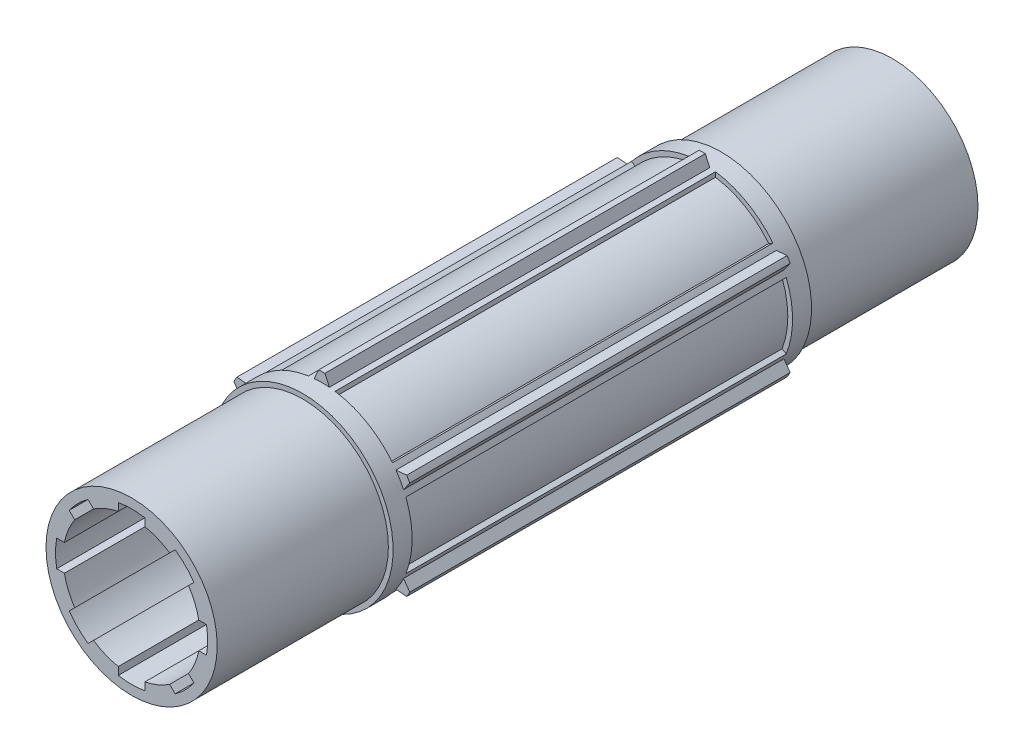
from build123d import *
from build123d.topology import SkipClean

# Parameters (mm, degrees)
SKETCH1_R           = 22.5
BOSS_EXTRUDE1_DEPTH = 200
BOSS_EXTRUDE2_START = 50
BOSS_EXTRUDE2_DEPTH = 100
BOSS_EXTRUDE3_START = -50
SKETCH4_R           = 23.75
SKETCH4_R_2         = 22.5
BOSS_EXTRUDE3_DEPTH = 5
BOSS_EXTRUDE4_START = -155
SKETCH4_2_R         = 23.75
SKETCH4_2_R_2       = 22.5
BOSS_EXTRUDE4_DEPTH = 5


with BuildPart() as part:
    # Sketch1 → Boss-Extrude1 (new body)
    with BuildSketch(Plane.XY):
        Circle(SKETCH1_R)
        with BuildLine():
            Line((-3.5, 19.691368668), (-3.5, 17.656443583))
            ThreePointArc((-3.5, 17.656443583), (-6.888301783, 16.629831585), (-10.010117255, 14.959864723))
            Line((-10.010117255, 14.959864723), (-11.449026581, 16.39877405))
            ThreePointArc((-11.449026581, 16.39877405), (-14.142135624, 14.142135624), (-16.39877405, 11.449026581))
            Line((-16.39877405, 11.449026581), (-14.959864723, 10.010117255))
            ThreePointArc((-14.959864723, 10.010117255), (-16.629831585, 6.888301783), (-17.656443583, 3.5))
            Line((-17.656443583, 3.5), (-19.691368668, 3.5))
            ThreePointArc((-19.691368668, 3.5), (-20, 0), (-19.691368668, -3.5))
            Line((-19.691368668, -3.5), (-17.656443583, -3.5))
            ThreePointArc((-17.656443583, -3.5), (-16.629831585, -6.888301783), (-14.959864723, -10.010117255))
            Line((-14.959864723, -10.010117255), (-16.39877405, -11.449026581))
            ThreePointArc((-16.39877405, -11.449026581), (-14.142135624, -14.142135624), (-11.449026581, -16.39877405))
            Line((-11.449026581, -16.39877405), (-10.010117255, -14.959864723))
            ThreePointArc((-10.010117255, -14.959864723), (-6.888301783, -16.629831585), (-3.5, -17.656443583))
            Line((-3.5, -17.656443583), (-3.5, -19.691368668))
            ThreePointArc((-3.5, -19.691368668), (0, -20), (3.5, -19.691368668))
            Line((3.5, -19.691368668), (3.5, -17.656443583))
            ThreePointArc((3.5, -17.656443583), (6.888301783, -16.629831585), (10.010117255, -14.959864723))
            Line((10.010117255, -14.959864723), (11.449026581, -16.39877405))
            ThreePointArc((11.449026581, -16.39877405), (14.142135624, -14.142135624), (16.39877405, -11.449026581))
            Line((16.39877405, -11.449026581), (14.959864723, -10.010117255))
            ThreePointArc((14.959864723, -10.010117255), (16.629831585, -6.888301783), (17.656443583, -3.5))
            Line((17.656443583, -3.5), (19.691368668, -3.5))
            ThreePointArc((19.691368668, -3.5), (20, 0), (19.691368668, 3.5))
            Line((19.691368668, 3.5), (17.656443583, 3.5))
            ThreePointArc((17.656443583, 3.5), (16.629831585, 6.888301783), (14.959864723, 10.010117255))
            Line((14.959864723, 10.010117255), (16.39877405, 11.449026581))
            ThreePointArc((16.39877405, 11.449026581), (14.142135624, 14.142135624), (11.449026581, 16.39877405))
            Line((11.449026581, 16.39877405), (10.010117255, 14.959864723))
            ThreePointArc((10.010117255, 14.959864723), (6.888301783, 16.629831585), (3.5, 17.656443583))
            Line((3.5, 17.656443583), (3.5, 19.691368668))
            ThreePointArc((3.5, 19.691368668), (0, 20), (-3.5, 19.691368668))
        make_face(mode=Mode.SUBTRACT)
    extrude(amount=BOSS_EXTRUDE1_DEPTH)

    # Sketch3 → Boss-Extrude2 (add)
    with BuildSketch(Plane.XY.offset(BOSS_EXTRUDE2_START)):
        with BuildLine():
            Line((-2, 23.665639649), (-0.800587161, 26.237788783))
            ThreePointArc((-0.800587161, 26.237788783), (0, 26.25), (0.800587161, 26.237788783))
            Line((0.800587161, 26.237788783), (2, 23.665639649))
            ThreePointArc((2, 23.665639649), (2.751390898, 23.590090041), (3.5, 23.490689645))
            Line((3.5, 23.490689645), (3.5, 22.226110771))
            ThreePointArc((3.5, 22.226110771), (0, 22.5), (-3.5, 22.226110771))
            Line((-3.5, 22.226110771), (-3.5, 23.490689645))
            ThreePointArc((-3.5, 23.490689645), (-2.751390898, 23.590090041), (-2, 23.665639649))
        make_face()
        with BuildLine():
            Line((17.498376555, 14.144144299), (18.593533985, 14.776433736))
            ThreePointArc((18.593533985, 14.776433736), (19.053921804, 14.177819434), (19.495045133, 13.564870632))
            Line((19.495045133, 13.564870632), (22.322298044, 13.812223211))
            ThreePointArc((22.322298044, 13.812223211), (22.733166849, 13.125), (23.122885205, 12.425565572))
            Line((23.122885205, 12.425565572), (21.495045133, 10.100769017))
            ThreePointArc((21.495045133, 10.100769017), (21.805312702, 9.412270607), (22.093533985, 8.714255909))
            Line((22.093533985, 8.714255909), (20.998376555, 8.081966472))
            ThreePointArc((20.998376555, 8.081966472), (19.485571585, 11.25), (17.498376555, 14.144144299))
        make_face()
        with BuildLine():
            Line((20.998376555, -8.081966472), (22.093533985, -8.714255909))
            ThreePointArc((22.093533985, -8.714255909), (21.805312702, -9.412270607), (21.495045133, -10.100769017))
            Line((21.495045133, -10.100769017), (23.122885205, -12.425565572))
            ThreePointArc((23.122885205, -12.425565572), (22.733166849, -13.125), (22.322298044, -13.812223211))
            Line((22.322298044, -13.812223211), (19.495045133, -13.564870632))
            ThreePointArc((19.495045133, -13.564870632), (19.053921804, -14.177819434), (18.593533985, -14.776433736))
            Line((18.593533985, -14.776433736), (17.498376555, -14.144144299))
            ThreePointArc((17.498376555, -14.144144299), (19.485571585, -11.25), (20.998376555, -8.081966472))
        make_face()
        with BuildLine():
            Line((3.5, -22.226110771), (3.5, -23.490689645))
            ThreePointArc((3.5, -23.490689645), (2.751390898, -23.590090041), (2, -23.665639649))
            Line((2, -23.665639649), (0.800587161, -26.237788783))
            ThreePointArc((0.800587161, -26.237788783), (0, -26.25), (-0.800587161, -26.237788783))
            Line((-0.800587161, -26.237788783), (-2, -23.665639649))
            ThreePointArc((-2, -23.665639649), (-2.751390898, -23.590090041), (-3.5, -23.490689645))
            Line((-3.5, -23.490689645), (-3.5, -22.226110771))
            ThreePointArc((-3.5, -22.226110771), (0, -22.5), (3.5, -22.226110771))
        make_face()
        with BuildLine():
            Line((-17.498376555, -14.144144299), (-18.593533985, -14.776433736))
            ThreePointArc((-18.593533985, -14.776433736), (-19.053921804, -14.177819434), (-19.495045133, -13.564870632))
            Line((-19.495045133, -13.564870632), (-22.322298044, -13.812223211))
            ThreePointArc((-22.322298044, -13.812223211), (-22.733166849, -13.125), (-23.122885205, -12.425565572))
            Line((-23.122885205, -12.425565572), (-21.495045133, -10.100769017))
            ThreePointArc((-21.495045133, -10.100769017), (-21.805312702, -9.412270607), (-22.093533985, -8.714255909))
            Line((-22.093533985, -8.714255909), (-20.998376555, -8.081966472))
            ThreePointArc((-20.998376555, -8.081966472), (-19.485571585, -11.25), (-17.498376555, -14.144144299))
        make_face()
        with BuildLine():
            Line((-20.998376555, 8.081966472), (-22.093533985, 8.714255909))
            ThreePointArc((-22.093533985, 8.714255909), (-21.805312702, 9.412270607), (-21.495045133, 10.100769017))
            Line((-21.495045133, 10.100769017), (-23.122885205, 12.425565572))
            ThreePointArc((-23.122885205, 12.425565572), (-22.733166849, 13.125), (-22.322298044, 13.812223211))
            Line((-22.322298044, 13.812223211), (-19.495045133, 13.564870632))
            ThreePointArc((-19.495045133, 13.564870632), (-19.053921804, 14.177819434), (-18.593533985, 14.776433736))
            Line((-18.593533985, 14.776433736), (-17.498376555, 14.144144299))
            ThreePointArc((-17.498376555, 14.144144299), (-19.485571585, 11.25), (-20.998376555, 8.081966472))
        make_face()
    extrude(amount=BOSS_EXTRUDE2_DEPTH)

    # Sketch4 → Boss-Extrude3 (add)
    with SkipClean():  # the faces are left unmerged after this step: merging them gives an invalid solid
        with BuildSketch(Plane.XY.offset(200).offset(BOSS_EXTRUDE3_START)):
            with Locations(Location((0, 0, 0), (0, 0, 180))):
                Circle(SKETCH4_R)
            with Locations(Location((0, 0, 0), (0, 0, 180))):
                Circle(SKETCH4_R_2, mode=Mode.SUBTRACT)
        extrude(amount=BOSS_EXTRUDE3_DEPTH)

    # Sketch4<2> → Boss-Extrude4 (add)
    with SkipClean():  # the faces are left unmerged after this step: merging them gives an invalid solid
        with BuildSketch(Plane.XY.offset(200).offset(BOSS_EXTRUDE4_START)):
            with Locations(Location((0, 0, 0), (0, 0, 180))):
                Circle(SKETCH4_2_R)
            with Locations(Location((0, 0, 0), (0, 0, 180))):
                Circle(SKETCH4_2_R_2, mode=Mode.SUBTRACT)
        extrude(amount=BOSS_EXTRUDE4_DEPTH)


solid = part.part
